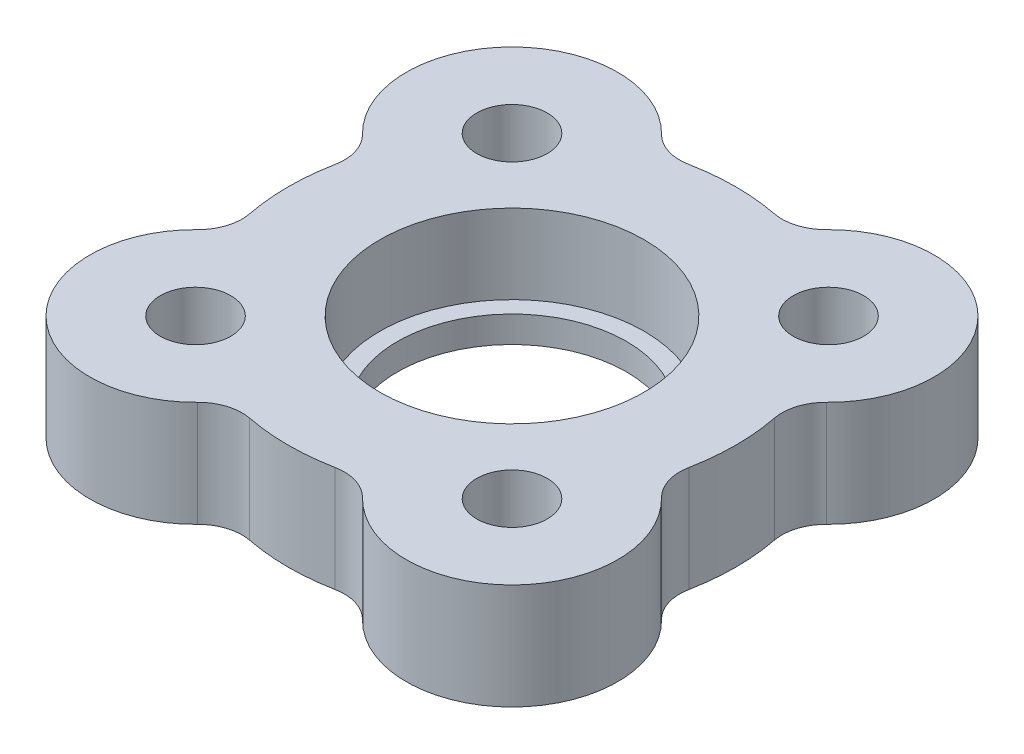
from build123d import *

# Parameters (mm, degrees)
SKETCH1_R                 = 4
SKETCH1_R_2               = 13
BODY_AND_MAIN_HOLES_DEPTH = 12
SKETCH3_R                 = 15
BEARING_HOLE_DEPTH        = 9


with BuildPart() as part:
    # Sketch1 → body and main holes (new body)
    with BuildSketch(Plane(origin=(0, 0, 0), x_dir=(1, 0, 0), z_dir=(0, 1, 0))):
        with BuildLine():
            ThreePointArc((-9.377544991, 26.346969967), (-26.445793616, 26.445793616), (-26.346969967, 9.377544991))
            ThreePointArc((-26.346969967, 9.377544991), (-25.068329757, 7.290769599), (-24.9332143, 4.847146031))
            ThreePointArc((-24.9332143, 4.847146031), (-25.4, 0), (-24.9332143, -4.847146031))
            ThreePointArc((-24.9332143, -4.847146031), (-25.068329757, -7.290769599), (-26.346969967, -9.377544991))
            ThreePointArc((-26.346969967, -9.377544991), (-26.445793616, -26.445793616), (-9.377544991, -26.346969967))
            ThreePointArc((-9.377544991, -26.346969967), (-7.290769599, -25.068329757), (-4.847146031, -24.9332143))
            ThreePointArc((-4.847146031, -24.9332143), (0, -25.4), (4.847146031, -24.9332143))
            ThreePointArc((4.847146031, -24.9332143), (7.290769599, -25.068329757), (9.377544991, -26.346969967))
            ThreePointArc((9.377544991, -26.346969967), (26.445793616, -26.445793616), (26.346969967, -9.377544991))
            ThreePointArc((26.346969967, -9.377544991), (25.068329757, -7.290769599), (24.9332143, -4.847146031))
            ThreePointArc((24.9332143, -4.847146031), (25.4, 0), (24.9332143, 4.847146031))
            ThreePointArc((24.9332143, 4.847146031), (25.068329757, 7.290769599), (26.346969967, 9.377544991))
            ThreePointArc((26.346969967, 9.377544991), (26.445793616, 26.445793616), (9.377544991, 26.346969967))
            ThreePointArc((9.377544991, 26.346969967), (7.290769599, 25.068329757), (4.847146031, 24.9332143))
            ThreePointArc((4.847146031, 24.9332143), (0, 25.4), (-4.847146031, 24.9332143))
            ThreePointArc((-4.847146031, 24.9332143), (-7.290769599, 25.068329757), (-9.377544991, 26.346969967))
        make_face()
        with Locations(Location((-17.960512242, 17.960512242, 0), (0, 0, 270))):
            Circle(SKETCH1_R, mode=Mode.SUBTRACT)
        with Locations(Location((17.960512242, 17.960512242, 0), (0, 0, 270))):
            Circle(SKETCH1_R, mode=Mode.SUBTRACT)
        with Locations(Location((17.960512242, -17.960512242, 0), (0, 0, 270))):
            Circle(SKETCH1_R, mode=Mode.SUBTRACT)
        with Locations(Location((-17.960512242, -17.960512242, 0), (0, 0, 270))):
            Circle(SKETCH1_R, mode=Mode.SUBTRACT)
        with Locations(Location((0, 0, 0), (0, 0, 270))):
            Circle(SKETCH1_R_2, mode=Mode.SUBTRACT)
    extrude(amount=BODY_AND_MAIN_HOLES_DEPTH)

    # Sketch3 → bearing hole (cut)
    with BuildSketch(Plane.XZ.offset(-12)):
        with Locations(Location((0, 0, 0), (0, 0, 270))):
            Circle(SKETCH3_R)
    extrude(amount=BEARING_HOLE_DEPTH, mode=Mode.SUBTRACT)


solid = part.part
